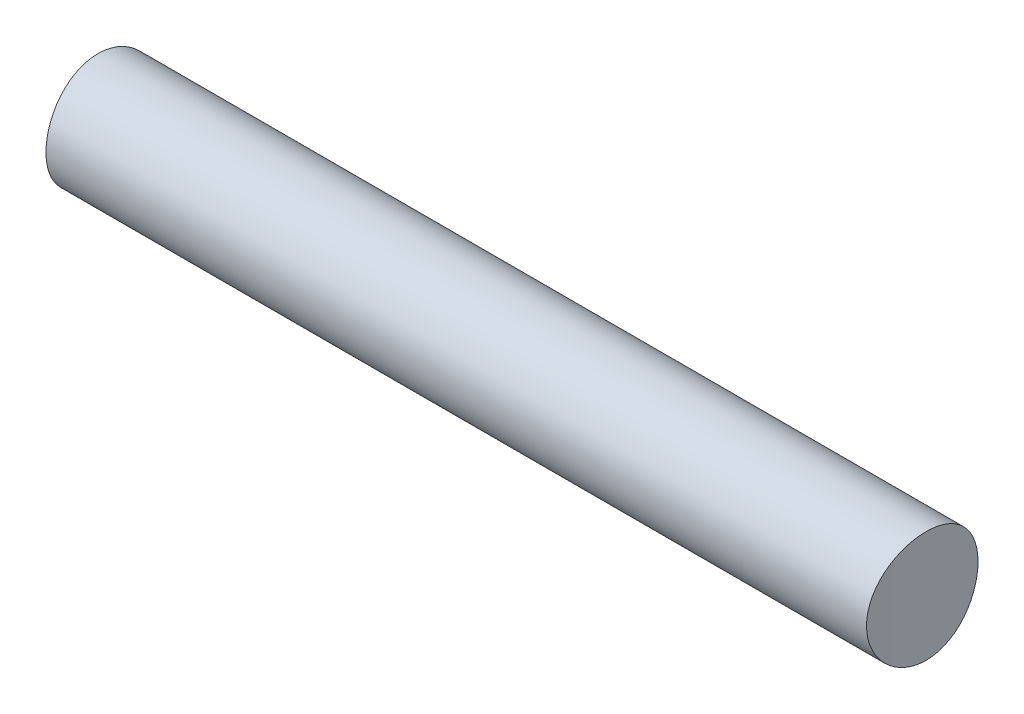
from build123d import *

# Parameters (mm, degrees)
SKETCH1_R               = 50.8
BOSS_EXTRUDE1_DEPTH     = 377.19
CUT_EXTRUDE1_DEPTH      = 384.970801103
CUT_EXTRUDE1_DEPTH_BACK = 384.970801103


with BuildPart() as part:
    # Sketch1 → Boss-Extrude1 (new, symmetric)
    with BuildSketch(Plane(origin=(0, 0, 0), x_dir=(0, 0, -1), z_dir=(1, 0, 0))):
        Circle(SKETCH1_R)
    extrude(amount=BOSS_EXTRUDE1_DEPTH, both=True)

    # Sketch2 → Cut-Extrude1 (cut, two sides: drawn at the far end of the back side and taken through both)
    with BuildSketch(Plane(origin=(0, 0, 0), x_dir=(1, 0, 0), z_dir=(0, 1, 0)).offset(-CUT_EXTRUDE1_DEPTH_BACK)):
        with BuildLine():
            Line((-373.753469683, 50.8), (-377.19, 50.8))
            Line((-377.19, 50.8), (-403.126645184, 50.8))
            Line((-403.126645184, 50.8), (-403.126645184, -50.8))
            Line((-403.126645184, -50.8), (-373.753469683, -50.8))
            ThreePointArc((-373.753469683, -50.8), (-377.19, 0), (-373.753469683, 50.8))
        make_face()
        with BuildLine():
            Line((414.154835098, 50.8), (373.753469683, 50.8))
            ThreePointArc((373.753469683, 50.8), (376.329886755, 25.458052462), (377.19, 0))
            ThreePointArc((377.19, 0), (376.329886755, -25.458052462), (373.753469683, -50.8))
            Line((373.753469683, -50.8), (377.19, -50.8))
            Line((377.19, -50.8), (414.154835098, -50.8))
            Line((414.154835098, -50.8), (414.154835098, 50.8))
        make_face()
    extrude(amount=CUT_EXTRUDE1_DEPTH + CUT_EXTRUDE1_DEPTH_BACK, mode=Mode.SUBTRACT)


solid = part.part
